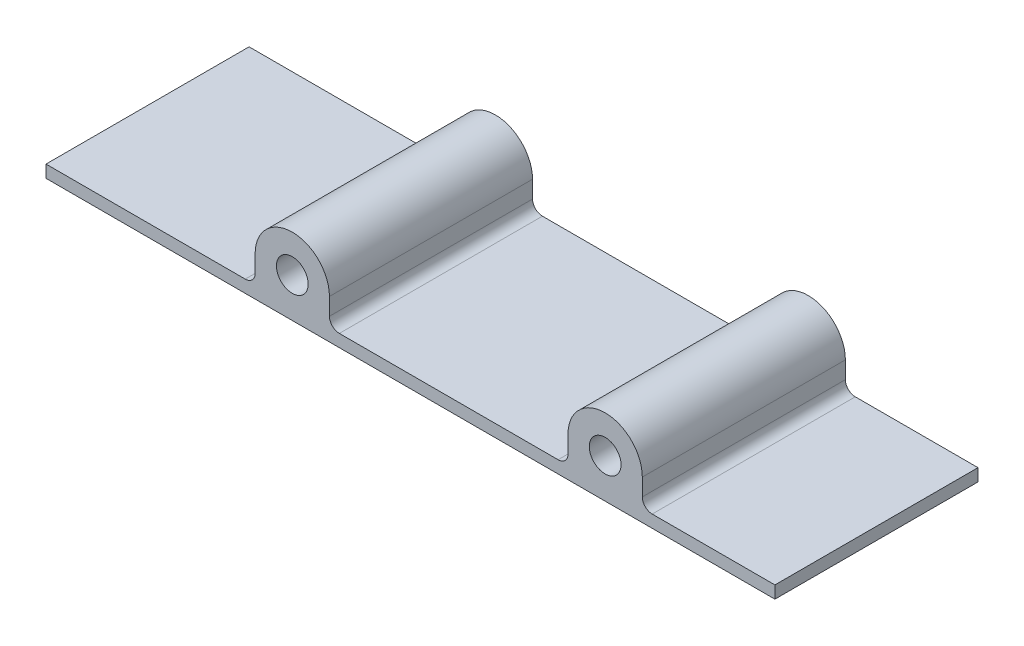
from build123d import *

# Parameters (mm, degrees)
SKETCH1_W           = 399.27784
SKETCH1_H           = 3.175
BOSS_EXTRUDE1_DEPTH = 52.09999994
SKETCH3_R           = 4.075
BOSS_EXTRUDE2_DEPTH = 52.09999994
FILLET1_R           = 2.54
SKETCH5_W           = 212.27542
SKETCH5_H           = 58.123397562
CUT_EXTRUDE3_DEPTH  = 404.141539965


with BuildPart() as part:
    # Sketch1 → Boss-Extrude1 (new body)
    with BuildSketch(Plane.XY):
        with Locations((199.63892, 1.5875)):
            Rectangle(SKETCH1_W, SKETCH1_H)
    extrude(amount=BOSS_EXTRUDE1_DEPTH)

    # Sketch3 → Boss-Extrude2 (add)
    # profile 1 of 4: a face of its own
    with BuildSketch(Plane(origin=(0, 0, 0), x_dir=(-1, 0, 0), z_dir=(0, 0, -1))):
        with BuildLine():
            Line((-313.50704, 10.11428), (-313.50704, 3.175))
            Line((-313.50704, 3.175), (-303.97704, 3.175))
            Line((-303.97704, 3.175), (-294.44704, 3.175))
            Line((-294.44704, 3.175), (-294.44704, 10.11428))
            ThreePointArc((-294.44704, 10.11428), (-303.97704, 19.64428), (-313.50704, 10.11428))
        make_face()
        with Locations((-303.97704, 10.11428)):
            Circle(SKETCH3_R, mode=Mode.SUBTRACT)
    # profile 2 of 4: a face of its own
    with BuildSketch(Plane(origin=(0, 0, 0), x_dir=(-1, 0, 0), z_dir=(0, 0, -1))):
        with BuildLine():
            Line((-233.24304, 3.175), (-223.71304, 3.175))
            Line((-223.71304, 3.175), (-214.18304, 3.175))
            Line((-214.18304, 3.175), (-214.18304, 10.11428))
            ThreePointArc((-214.18304, 10.11428), (-223.71304, 19.64428), (-233.24304, 10.11428))
            Line((-233.24304, 10.11428), (-233.24304, 3.175))
        make_face()
        with Locations((-223.71304, 10.11428)):
            Circle(SKETCH3_R, mode=Mode.SUBTRACT)
    # profile 3 of 4: a face of its own
    with BuildSketch(Plane(origin=(0, 0, 0), x_dir=(-1, 0, 0), z_dir=(0, 0, -1))):
        with BuildLine():
            Line((-152.97904, 3.175), (-143.44904, 3.175))
            Line((-143.44904, 3.175), (-133.91904, 3.175))
            Line((-133.91904, 3.175), (-133.91904, 10.11428))
            ThreePointArc((-133.91904, 10.11428), (-143.44904, 19.64428), (-152.97904, 10.11428))
            Line((-152.97904, 10.11428), (-152.97904, 3.175))
        make_face()
        with Locations((-143.44904, 10.11428)):
            Circle(SKETCH3_R, mode=Mode.SUBTRACT)
    # profile 4 of 4: a face of its own
    with BuildSketch(Plane(origin=(0, 0, 0), x_dir=(-1, 0, 0), z_dir=(0, 0, -1))):
        with BuildLine():
            Line((-72.71504, 3.175), (-63.18504, 3.175))
            Line((-63.18504, 3.175), (-53.65504, 3.175))
            Line((-53.65504, 3.175), (-53.65504, 10.11428))
            ThreePointArc((-53.65504, 10.11428), (-63.18504, 19.64428), (-72.71504, 10.11428))
            Line((-72.71504, 10.11428), (-72.71504, 3.175))
        make_face()
        with Locations((-63.18504, 10.11428)):
            Circle(SKETCH3_R, mode=Mode.SUBTRACT)
    extrude(amount=-BOSS_EXTRUDE2_DEPTH)

    # Fillet1
    fillet1_edges = [part.edges().sort_by_distance(p)[0] for p in [
        (294.44704, 3.175, 26.04999997),
        (313.50704, 3.175, 26.04999997),
        (233.24304, 3.175, 26.04999997),
        (214.18304, 3.175, 26.04999997),
        (152.97904, 3.175, 26.04999997),
        (133.91904, 3.175, 26.04999997),
        (72.71504, 3.175, 26.04999997),
        (53.65504, 3.175, 26.04999997),
    ]]
    fillet(fillet1_edges, radius=FILLET1_R)

    # Sketch5 → Cut-Extrude3 (cut, through all)
    with BuildSketch(Plane(origin=(0, 0, 0), x_dir=(-1, 0, 0), z_dir=(0, 0, -1))):
        with Locations((-293.14013, 29.061698781)):
            Rectangle(SKETCH5_W, SKETCH5_H)
    extrude(amount=-CUT_EXTRUDE3_DEPTH, mode=Mode.SUBTRACT)


solid = part.part
